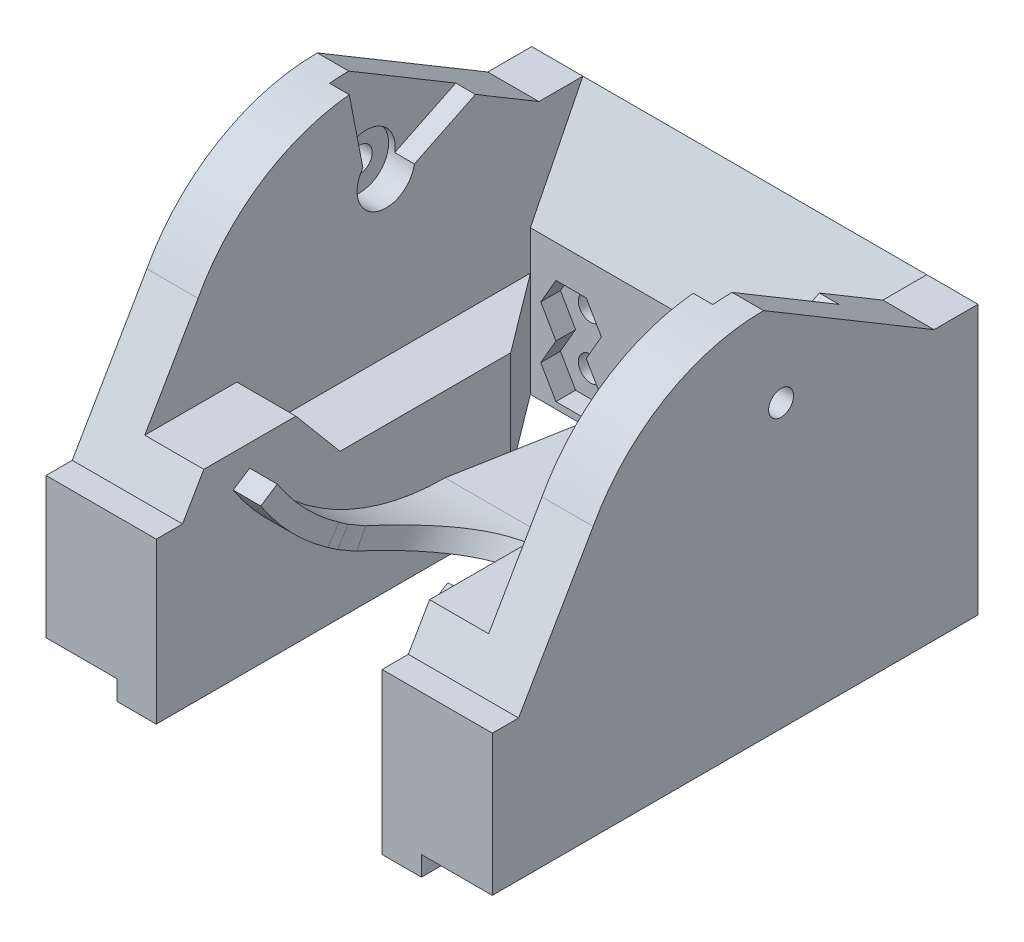
from build123d import *

# Parameters (mm, degrees)
CROQUIS1_W                 = 34
CROQUIS1_H                 = 19
SALIENTE_EXTRUIR1_DEPTH    = 35
CROQUIS2_W                 = 26.2
CROQUIS2_H                 = 31
CORTAR_EXTRUIR1_DEPTH      = 25
CORTAR_EXTRUIR3_DEPTH      = 26.2
SALIENTE_EXTRUIR2_DEPTH    = 34
CROQUIS10_W                = 26.2
CROQUIS10_H                = 25.966324345
CORTAR_EXTRUIR4_DEPTH      = 10
CROQUIS18_R                = 0.95
CORTAR_EXTRUIR11_DEPTH     = 4
CORTAR_EXTRUIR12_DEPTH     = 1.5
CORTAR_EXTRUIR14_START     = -34
CROQUIS21_R                = 0.95
CORTAR_EXTRUIR14_DEPTH     = 34
SALIENTE_EXTRUIR3_DEPTH    = 8
CROQUIS25_W                = 3
CROQUIS25_H                = 25
SALIENTE_EXTRUIR4_DEPTH    = 3
CROQUIS43_W                = 4.5
CROQUIS43_H                = 12
SALIENTE_EXTRUIR8_DEPTH    = 4
CORTAR_EXTRUIR20_START     = -1.5
CORTAR_EXTRUIR20_DEPTH     = 1.5
CORTAR_EXTRUIR21_DEPTH     = 27.7
CORTAR_EXTRUIR22_START     = -34
CORTAR_EXTRUIR22_DEPTH     = 34
CROQUIS36_R                = 2.2
CORTAR_EXTRUIR24_DEPTH     = 2
CORTAR_EXTRUIR25_START     = 28.2
CROQUIS36_2_R              = 2.2
CORTAR_EXTRUIR25_DEPTH     = 28.2
CORTAR_EXTRUIR26_START     = -34
CORTAR_EXTRUIR26_DEPTH     = 34
CORTAR_EXTRUIR28_START     = -23.2
CORTAR_EXTRUIR28_DEPTH     = 23.2
CORTAR_EXTRUIR29_DEPTH     = 26.2
SALIENTE_EXTRUIR9_DEPTH    = 17.199997
CROQUIS49_R                = 6.5
CROQUIS50_R                = 6.5
SALIENTE_EXTRUIR15_DEPTH   = 2
SALIENTE_EXTRUIR15_2_DEPTH = 2
SALIENTE_EXTRUIR29_DEPTH   = 1.5
SALIENTE_EXTRUIR30_DEPTH   = 1.5


with BuildPart() as part:
    # Croquis1 → Saliente-Extruir1 (new body)
    with BuildSketch(Plane.XY):
        with Locations((-31.887263086, 5.12254902)):
            Rectangle(CROQUIS1_W, CROQUIS1_H)
    extrude(amount=SALIENTE_EXTRUIR1_DEPTH)

    # Croquis2 → Cortar-Extruir1 (cut)
    with BuildSketch(Plane.XZ.offset(4.37745098)):
        with Locations((-31.887263086, 19.5)):
            Rectangle(CROQUIS2_W, CROQUIS2_H)
    extrude(amount=-CORTAR_EXTRUIR1_DEPTH, mode=Mode.SUBTRACT)

    # Croquis4 → Cortar-Extruir3 (cut)
    with BuildSketch(Plane.ZY.offset(18.787263086)):
        Polygon((4, 14.62254902), (4, 6.62254902), (0, 14.62254902), align=None)
    extrude(amount=CORTAR_EXTRUIR3_DEPTH, mode=Mode.SUBTRACT)

    # Croquis9 → Saliente-Extruir2 (add)
    with BuildSketch(Plane(origin=(-14.887263086, 0, 0), x_dir=(0, 0, -1), z_dir=(1, 0, 0))):
        with BuildLine():
            Line((-29.315831827, 14.62254902), (-3.349507482, 14.62254902))
            ThreePointArc((-3.349507482, 14.62254902), (-16.332669655, 22.37254902), (-29.315831827, 14.62254902))
        make_face()
    extrude(amount=-SALIENTE_EXTRUIR2_DEPTH)

    # Croquis10 → Cortar-Extruir4 (cut)
    with BuildSketch(Plane.XZ.offset(-14.62254902)):
        with Locations((-31.887263086, 16.332669655)):
            Rectangle(CROQUIS10_W, CROQUIS10_H)
    extrude(amount=-CORTAR_EXTRUIR4_DEPTH, mode=Mode.SUBTRACT)

    # Croquis18 → Cortar-Extruir11 (cut)
    with BuildSketch(Plane(origin=(0, 0, 0), x_dir=(-1, 0, 0), z_dir=(0, 0, -1))):
        with Locations((41.887263086, -1.87745098)):
            Circle(CROQUIS18_R)
        with Locations((21.887263086, -1.87745098)):
            Circle(CROQUIS18_R)
        with Locations((21.887263086, 2.12254902)):
            Circle(CROQUIS18_R)
        with Locations((41.887263086, 2.12254902)):
            Circle(CROQUIS18_R)
    extrude(amount=-CORTAR_EXTRUIR11_DEPTH, mode=Mode.SUBTRACT)

    # Croquis19 → Cortar-Extruir12 (cut)
    with BuildSketch(Plane.XY.offset(4)):
        Polygon((-44.197263086, -1.87745098), (-43.042263086, -3.877969663), (-40.732263086, -3.877969663), (-39.577263086, -1.87745098), (-40.731963624, 0.12254902), (-39.577263086, 2.12254902), (-40.732263086, 4.123067702), (-43.042263086, 4.123067702), (-44.197263086, 2.12254902), (-43.042562547, 0.12254902), align=None)
        Polygon((-24.197263086, -1.87745098), (-23.042263086, -3.877969663), (-20.732263086, -3.877969663), (-19.577263086, -1.87745098), (-20.731963624, 0.12254902), (-19.577263086, 2.12254902), (-20.732263086, 4.123067702), (-23.042263086, 4.123067702), (-24.197263086, 2.12254902), (-23.042562547, 0.12254902), align=None)
    extrude(amount=-CORTAR_EXTRUIR12_DEPTH, mode=Mode.SUBTRACT)

    # Croquis21 → Cortar-Extruir14 (cut)
    with BuildSketch(Plane(origin=(-14.887263086, 0, 0), x_dir=(0, 0, -1), z_dir=(1, 0, 0)).offset(CORTAR_EXTRUIR14_START)):
        with Locations((-15, 15.62254902)):
            Circle(CROQUIS21_R)
    extrude(amount=CORTAR_EXTRUIR14_DEPTH, mode=Mode.SUBTRACT)

    # Croquis23 → Saliente-Extruir3 (add)
    with BuildSketch(Plane.XZ.offset(4.37745098)):
        Polygon((-44.987263086, 35), (-40.487263086, 35), (-40.487263086, 10), (-44.987263086, 4), align=None)
        Polygon((-18.787263086, 35), (-23.287263086, 35), (-23.287263086, 10), (-18.787263086, 4), align=None)
    extrude(amount=-SALIENTE_EXTRUIR3_DEPTH)

    # Croquis25 → Saliente-Extruir4 (add)
    with BuildSketch(Plane.XZ.offset(4.37745098)):
        with Locations((-41.987263086, 22.5)):
            Rectangle(CROQUIS25_W, CROQUIS25_H)
        with Locations((-21.787263086, 22.5)):
            Rectangle(CROQUIS25_W, CROQUIS25_H)
    extrude(amount=SALIENTE_EXTRUIR4_DEPTH)

    # Croquis43 → Saliente-Extruir8 (add)
    with BuildSketch(Plane(origin=(0, 3.62254902, 0), x_dir=(1, 0, 0), z_dir=(0, 1, 0))):
        with Locations((-21.037263086, -29)):
            Rectangle(CROQUIS43_W, CROQUIS43_H)
        with Locations((-42.737263086, -29)):
            Rectangle(CROQUIS43_W, CROQUIS43_H)
    extrude(amount=SALIENTE_EXTRUIR8_DEPTH)

    # Croquis29 → Cortar-Extruir20 (cut)
    with BuildSketch(Plane.ZY.offset(18.787263086).offset(CORTAR_EXTRUIR20_START)):
        with BuildLine():
            Line((17.797402962, 22.299641931), (16.5, 15.62254902))
            ThreePointArc((16.5, 15.62254902), (15.426958984, 14.184596995), (13.743058632, 14.803953638))
            Line((13.743058632, 14.803953638), (6.296886003, 18.432060872))
            ThreePointArc((6.296886003, 18.432060872), (11.631045274, 21.603150873), (17.797402962, 22.299641931))
        make_face()
    extrude(amount=CORTAR_EXTRUIR20_DEPTH, mode=Mode.SUBTRACT)

    # Croquis29<2> → Cortar-Extruir21 (cut)
    with BuildSketch(Plane.ZY.offset(18.787263086)):
        with BuildLine():
            Line((17.797402962, 22.299641931), (16.5, 15.62254902))
            ThreePointArc((16.5, 15.62254902), (15.426958984, 14.184596995), (13.743058632, 14.803953638))
            Line((13.743058632, 14.803953638), (6.296886003, 18.432060872))
            ThreePointArc((6.296886003, 18.432060872), (11.631045274, 21.603150873), (17.797402962, 22.299641931))
        make_face()
    extrude(amount=CORTAR_EXTRUIR21_DEPTH, mode=Mode.SUBTRACT)

    # Croquis30 → Cortar-Extruir22 (cut)
    with BuildSketch(Plane.ZY.offset(48.887263086).offset(CORTAR_EXTRUIR22_START)):
        Polygon((29.315831827, 14.62254902), (35, 4.827802707), (35, 14.62254902), align=None)
    extrude(amount=CORTAR_EXTRUIR22_DEPTH, mode=Mode.SUBTRACT)

    # Croquis36 → Cortar-Extruir24 (cut)
    with BuildSketch(Plane.ZY.offset(18.787263086)):
        with Locations((15, 15.62254902)):
            Circle(CROQUIS36_R)
    extrude(amount=-CORTAR_EXTRUIR24_DEPTH, mode=Mode.SUBTRACT)

    # Croquis36<2> → Cortar-Extruir25 (cut)
    with BuildSketch(Plane.ZY.offset(18.787263086).offset(CORTAR_EXTRUIR25_START)):
        with Locations((15, 15.62254902)):
            Circle(CROQUIS36_2_R)
    extrude(amount=-CORTAR_EXTRUIR25_DEPTH, mode=Mode.SUBTRACT)

    # Croquis38 → Cortar-Extruir26 (cut)
    with BuildSketch(Plane.ZY.offset(48.887263086).offset(CORTAR_EXTRUIR26_START)):
        Polygon((3.349507482, 14.62254902), (16.332669655, 22.37254902), (3.349507482, 22.37254902), align=None)
    extrude(amount=CORTAR_EXTRUIR26_DEPTH, mode=Mode.SUBTRACT)

    # Croquis41 → Cortar-Extruir28 (cut)
    with BuildSketch(Plane(origin=(-20.287263086, 0, 0), x_dir=(0, 0, -1), z_dir=(1, 0, 0)).offset(CORTAR_EXTRUIR28_START)):
        Polygon((-10, -4.37745098), (-10, -7.37745098), (-13, -7.37745098), align=None)
    extrude(amount=CORTAR_EXTRUIR28_DEPTH, mode=Mode.SUBTRACT)

    # Croquis44 → Cortar-Extruir29 (cut)
    with BuildSketch(Plane.ZY.offset(18.787263086)):
        Polygon((23, 7.62254902), (26.362551066, 7.62254902), (23, 3.62254902), align=None)
    extrude(amount=CORTAR_EXTRUIR29_DEPTH, mode=Mode.SUBTRACT)



with BuildPart() as body_2:
    # Croquis45 → Saliente-Extruir9 (new body)
    with BuildSketch(Plane.ZY.offset(23.287263086)):
        with BuildLine():
            Line((31.142668885, 5.135569413), (29.884798582, 5.952736655))
            ThreePointArc((29.884798582, 5.952736655), (23.468274043, 0.022842781), (15, -2.12745098))
            Line((15, -2.12745098), (15, -3.62745098))
            ThreePointArc((15, -3.62745098), (24.183902835, -1.295442254), (31.142668885, 5.135569413))
        make_face()
    extrude(amount=SALIENTE_EXTRUIR9_DEPTH)

    # Cortar-Barrer2: sweep along a path in Croquis47
    with BuildLine(Plane(origin=(-31.887263086, 4.275439874, 32.372332418), x_dir=(0, 0, -1), z_dir=(1, 0, 0))) as cortar_barrer2_path:
        Line((17.372332418, 11.347109145), (-5.570725036, -21.418972626))
    # Croquis48 → Cortar-Barrer2 (sweep, cut)
    with BuildSketch(Plane(origin=(-31.887263086, -17.143532752, 37.943057454), x_dir=(-1, 0, 0), z_dir=(0, -0.8191520442889911, 0.5735764363510472))):
        with BuildLine():
            Line((6.5, 0), (6.5, -15))
            Line((6.5, -15), (-6.5, -15))
            Line((-6.5, -15), (-6.5, 0))
            ThreePointArc((-6.5, 0), (0, 6.5), (6.5, 0))
        make_face()
    sweep(path=cortar_barrer2_path.line, mode=Mode.SUBTRACT)

    # Cortar-Barrer3: sweep along a path in Croquis51
    with BuildLine(Plane(origin=(-31.887263086, 4.275439874, 32.372332418), x_dir=(0, 0, -1), z_dir=(1, 0, 0))) as cortar_barrer3_path:
        Line((17.372332418, 11.347109145), (-2.627667582, -23.293907006))
    # Croquis49 → Cortar-Barrer3 (sweep, cut)
    with BuildSketch(Plane(origin=(-31.887263086, -19.018467132, 35), x_dir=(-1, 0, 0), z_dir=(0, -0.8660254037844382, 0.5000000000000011))):
        Circle(CROQUIS49_R)
    sweep(path=cortar_barrer3_path.line, mode=Mode.SUBTRACT)

    # Cortar-Barrer4: sweep along a path in Croquis52
    with BuildLine(Plane(origin=(-31.887263086, 4.275439874, 32.372332418), x_dir=(0, 0, -1), z_dir=(1, 0, 0))) as cortar_barrer4_path:
        Line((17.372332418, 11.347109145), (0.467601948, -24.905202336))
    # Croquis50 → Cortar-Barrer4 (sweep, cut)
    with BuildSketch(Plane(origin=(-31.887263086, -20.629762462, 31.90473047), x_dir=(-1, 0, 0), z_dir=(0, -0.9063077870366495, 0.4226182617407004))):
        Circle(CROQUIS50_R)
    sweep(path=cortar_barrer4_path.line, mode=Mode.SUBTRACT)


with BuildPart() as body_3:
    # Croquis56 → Saliente-Extruir15 (new body)
    with BuildSketch(Plane.XY.offset(35)):
        Polygon((-23.287263086, -7.37745098), (-20.287263086, -7.37745098), (-20.287263086, -4.37745098), (-14.887263086, -4.37745098), (-14.887263086, 4.827802707), (-23.287263086, 4.827802707), align=None)
    extrude(amount=SALIENTE_EXTRUIR15_DEPTH)


with BuildPart() as body_4:
    # Croquis56 → Saliente-Extruir15 2 (new body)
    with BuildSketch(Plane.XY.offset(35)):
        Polygon((-40.487263086, -7.37745098), (-40.487263086, 4.827802707), (-48.887263086, 4.827802707), (-48.887263086, -4.37745098), (-43.487263086, -4.37745098), (-43.487263086, -7.37745098), align=None)
    extrude(amount=SALIENTE_EXTRUIR15_2_DEPTH)


with BuildPart() as body_5:
    # Croquis59 → Saliente-Extruir29 (new body)
    with BuildSketch(Plane.XZ.offset(3.62745098)):
        Polygon((-40.487263086, 15), (-23.287263086, 15), (-25.287263086, 3.999836098), (-38.487263086, 3.999836098), align=None)
    extrude(amount=-SALIENTE_EXTRUIR29_DEPTH)


with BuildPart() as part_1:
    add(part.part)

    add(body_3.part)  # Saliente-Extruir30 merges body 3

    add(body_4.part)  # Saliente-Extruir30 merges body 4
    # Croquis60 → Saliente-Extruir30 (add)
    with BuildSketch(Plane.XZ.offset(4.37745098)):
        Polygon((-48.887263086, 35), (-48.887263086, 0), (-43.487263086, 10), (-43.487263086, 35), (-43.487263086, 37), (-48.887263086, 37), align=None)
        Polygon((-14.887263086, 0), (-14.887263086, 37), (-20.287263086, 37), (-20.287263086, 10), align=None)
    extrude(amount=SALIENTE_EXTRUIR30_DEPTH)


solid = Compound([body_2.part, body_5.part, part_1.part])
